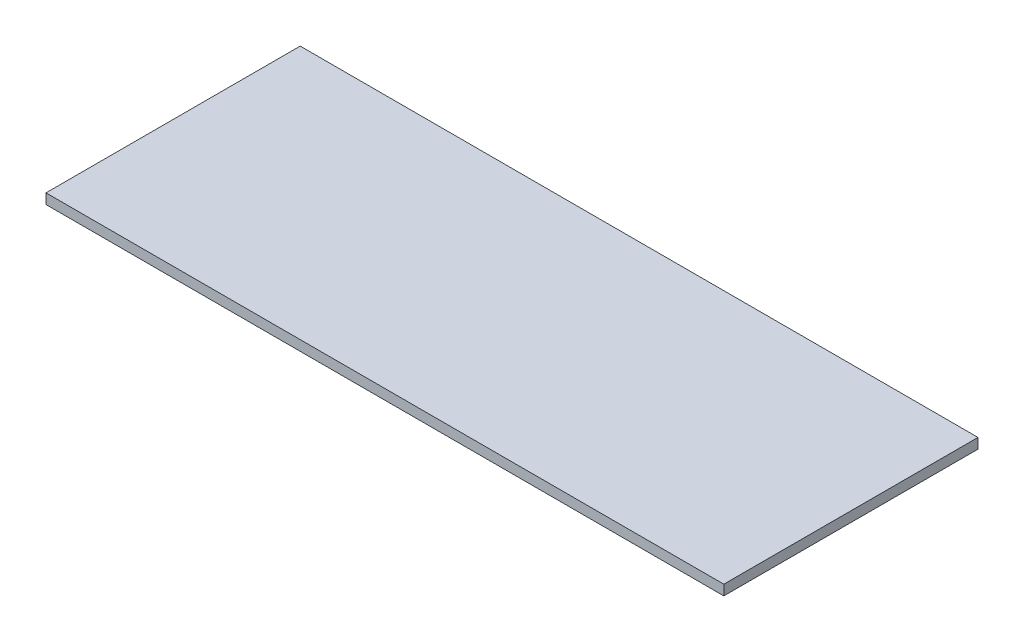
from build123d import *

# Parameters (mm, degrees)
SKETCH1_W           = 200
SKETCH1_H           = 75
BOSS_EXTRUDE1_DEPTH = 3


with BuildPart() as part:
    # Sketch1 → Boss-Extrude1 (new body)
    with BuildSketch(Plane(origin=(0, 0, 0), x_dir=(1, 0, 0), z_dir=(0, 1, 0))):
        Rectangle(SKETCH1_W, SKETCH1_H)
    extrude(amount=BOSS_EXTRUDE1_DEPTH)


solid = part.part
